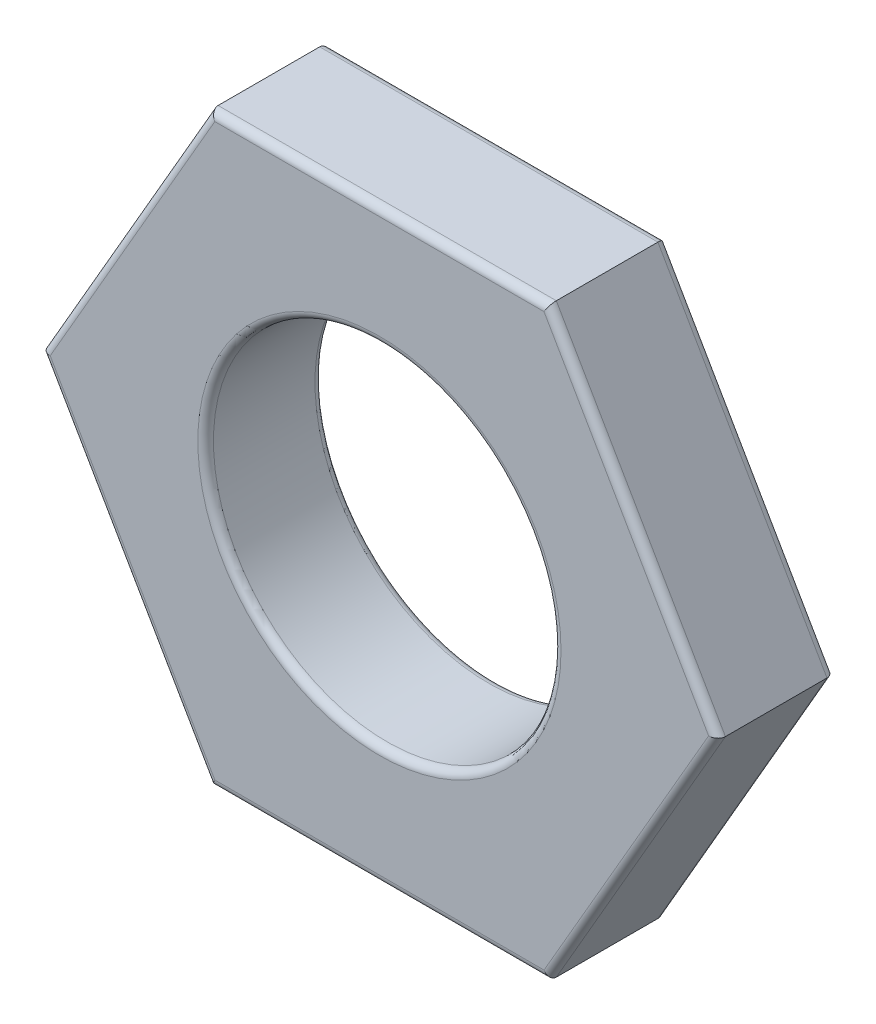
from build123d import *

# Parameters (mm, degrees)
EXTRUDE_1_DEPTH     = 15
SKETCH_2_R          = 22.25
CUT_EXTRUDE_2_DEPTH = 60.213596412
FILLET_1_R          = 1


with BuildPart() as part:
    # 草图1 → 拉伸1 (new body)
    with BuildSketch(Plane.XY):
        Polygon((21.650635095, -37.5), (43.301270189, 0), (21.650635095, 37.5), (-21.650635095, 37.5), (-43.301270189, 0), (-21.650635095, -37.5), align=None)
    extrude(amount=EXTRUDE_1_DEPTH)

    # 草图2 → 拉伸2 (cut, through all)
    with BuildSketch(Plane.XY.offset(15)):
        Circle(SKETCH_2_R)
    extrude(amount=-CUT_EXTRUDE_2_DEPTH, mode=Mode.SUBTRACT)

    # 圆角1
    fillet_1_edges = [part.edges().sort_by_distance(p)[0] for p in [
        (32.475952642, 18.75, 15),
        (0, 37.5, 15),
        (-32.475952642, 18.75, 15),
        (-32.475952642, -18.75, 15),
        (-22.25, 0, 0),
        (-22.25, 0, 15),
        (0, -37.5, 15),
        (-32.475952642, -18.75, 0),
        (-32.475952642, 18.75, 0),
        (0, 37.5, 0),
        (32.475952642, -18.75, 15),
        (32.475952642, 18.75, 0),
        (32.475952642, -18.75, 0),
        (0, -37.5, 0),
    ]]
    fillet(fillet_1_edges, radius=FILLET_1_R)


solid = part.part
